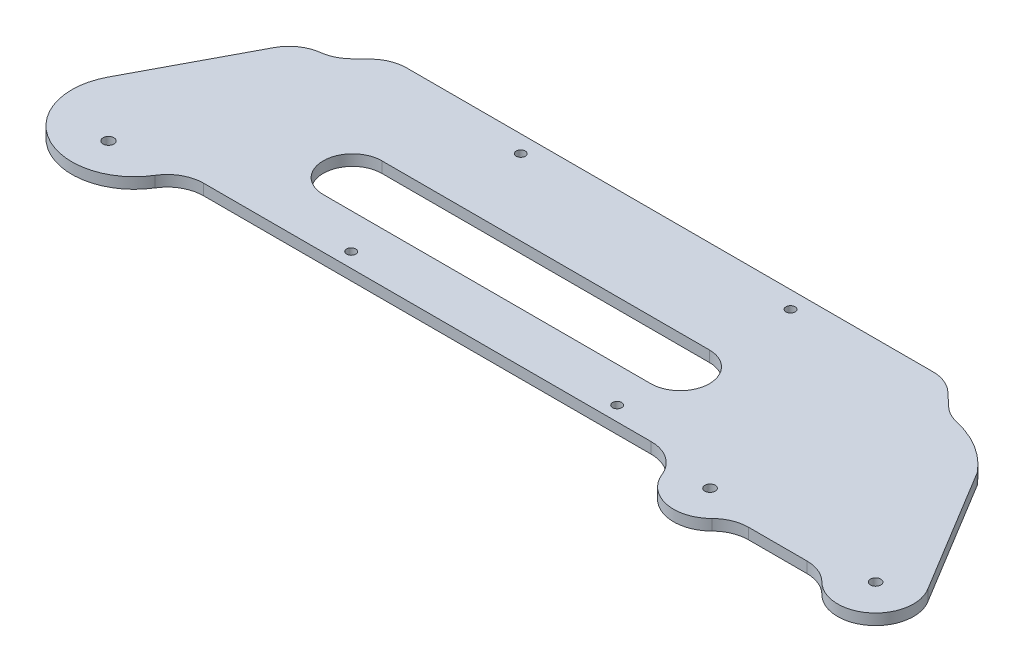
from build123d import *

# Parameters (mm, degrees)
SKETCH1_R           = 1.42
SKETCH1_R_2         = 1.5
BOSS_EXTRUDE1_DEPTH = 3
CUT_EXTRUDE1_DEPTH  = 10
SKETCH3_R           = 1.25
CUT_EXTRUDE2_DEPTH  = 4
FILLET3_R           = 10
FILLET5_R           = 10
FILLET6_R           = 10


with BuildPart() as part:
    # Sketch1 → Boss-Extrude1 (new body)
    with BuildSketch(Plane(origin=(0, 0, 0), x_dir=(1, 0, 0), z_dir=(0, 1, 0))):
        with BuildLine():
            ThreePointArc((133.875699804, 40.34048493), (126.122977609, 46.855267092), (116.497088404, 50))
            Line((116.497088404, 50), (107.768405602, 58.234688612))
            Line((107.768405602, 58.234688612), (-44.546790917, 58.234688612))
            Line((-44.546790917, 58.234688612), (-53.27547372, 50))
            Line((-53.27547372, 50), (-60.834293515, 50))
            Line((-60.834293515, 50), (-79.287118585, 15.140440013))
            ThreePointArc((-79.287118585, 15.140440013), (-70.265146029, -8.871003651), (-47.526969146, 3))
            Line((-47.526969146, 3), (90.594512312, 3))
            ThreePointArc((90.594512312, 3), (97.400879011, -9.399948213), (110.470105416, -3.988787107))
            Line((110.470105416, -3.988787107), (136.480218576, -3.988787107))
            ThreePointArc((136.480218576, -3.988787107), (150.979390144, -8.686037245), (154.629343476, 6.111529301))
            Line((154.629343476, 6.111529301), (133.875699804, 40.34048493))
        make_face()
        with Locations(Location((145.916308107, 0.41174787, 0), (0, 0, 270))):
            Circle(SKETCH1_R, mode=Mode.SUBTRACT)
        with Locations(Location((100.916308107, 0, 0), (0, 0, 270))):
            Circle(SKETCH1_R, mode=Mode.SUBTRACT)
        with Locations(Location((-64.083691893, 0, 0), (0, 0, 270))):
            Circle(SKETCH1_R_2, mode=Mode.SUBTRACT)
    extrude(amount=BOSS_EXTRUDE1_DEPTH)

    # Sketch2 → Cut-Extrude1 (cut)
    with BuildSketch(Plane(origin=(0, 3, 0), x_dir=(1, 0, 0), z_dir=(0, 1, 0))):
        with BuildLine():
            Line((67.972610999, 16.705365669), (-21.876516484, 16.705365669))
            ThreePointArc((-21.876516484, 16.705365669), (-29.906807538, 24.735656723), (-21.876516484, 32.765947778))
            Line((-21.876516484, 32.765947778), (67.972610999, 32.765947778))
            ThreePointArc((67.972610999, 32.765947778), (76.002902053, 24.735656723), (67.972610999, 16.705365669))
        make_face()
    extrude(amount=-CUT_EXTRUDE1_DEPTH, mode=Mode.SUBTRACT)

    # Sketch3 → Cut-Extrude2 (cut)
    with BuildSketch(Plane(origin=(0, 3, 0), x_dir=(1, 0, 0), z_dir=(0, 1, 0))):
        with Locations(Location((-4.515015694, 7, 0), (0, 0, 270))):
            Circle(SKETCH3_R)
        with Locations(Location((68.446888698, 7, 0), (0, 0, 270))):
            Circle(SKETCH3_R)
        with Locations(Location((-4.515015694, 53.518369915, 0), (0, 0, 270))):
            Circle(SKETCH3_R)
        with Locations(Location((69.48070481, 53.518369915, 0), (0, 0, 270))):
            Circle(SKETCH3_R)
    extrude(amount=-CUT_EXTRUDE2_DEPTH, mode=Mode.SUBTRACT)

    # Fillet3
    fillet3_edges = [part.edges().sort_by_distance(p)[0] for p in [
        (110.470105416, 1.5, 3.988787107),
        (90.594512312, 1.5, -3),
        (-47.526969146, 1.5, -3),
        (136.480218576, 1.5, 3.988787107),
    ]]
    fillet(fillet3_edges, radius=FILLET3_R)

    # Fillet5
    fillet5_edges = [part.edges().sort_by_distance(p)[0] for p in [
        (-53.27547372, 1.5, -50),
        (-44.546790917, 1.5, -58.234688612),
        (107.768405602, 1.5, -58.234688612),
        (116.497088404, 1.5, -50),
    ]]
    fillet(fillet5_edges, radius=FILLET5_R)

    # Fillet6
    fillet6_edges = [part.edges().sort_by_distance(p)[0] for p in [
        (-60.834293515, 1.5, -50),
    ]]
    fillet(fillet6_edges, radius=FILLET6_R)


solid = part.part
